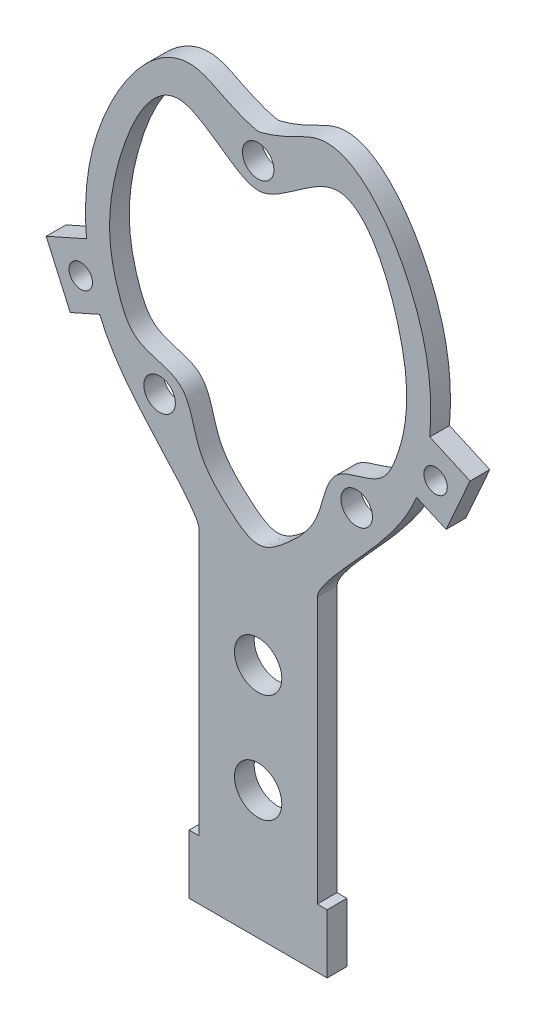
from build123d import *

# Parameters (mm, degrees)
SKETCH2_R           = 1.2
SKETCH2_R_2         = 0.8
BOSS_EXTRUDE2_DEPTH = 1
BOSS_EXTRUDE3_DEPTH = 1
SKETCH4_R           = 0.594999999
CUT_EXTRUDE10_DEPTH = 10


with BuildPart() as part:
    # Sketch2 → Boss-Extrude2 (new body)
    with BuildSketch(Plane.XY):
        with BuildLine():
            Line((-3, -25.6), (-3.5, -25.6))
            Line((-3.5, -25.6), (-3.5, -28.6))
            Line((-3.5, -28.6), (3.5, -28.6))
            Line((3.5, -28.6), (3.5, -25.6))
            Line((3.5, -25.6), (3, -25.6))
            Line((3, -25.6), (3, -12.1))
            add(Edge.make_bspline(
                [(3, -12.1), (3.058103828, -11.435870201), (7.372156419, -7.261735624), (8.816301548, -3.819636641), (8.795211315, 3.088220748), (4.729906031, 9.502714417), (1.543138013, 7.285247455), (0.138381747, 6.848730149), (-0.138381747, 6.848730149), (-1.543138013, 7.285247455), (-4.729906031, 9.502714417), (-8.795211315, 3.088220748), (-8.816301548, -3.819636641), (-7.372156419, -7.261735624), (-3.058103828, -11.435870201), (-3, -12.1)],
                knots=[0.110531839, 0.110531839, 0.110531839, 0.110531839, 0.195870509, 0.310871915, 0.375079995, 0.502014152, 0.537662278, 0.553505555, 0.557026284, 0.572869561, 0.608517687, 0.735451844, 0.799659924, 0.91466133, 1, 1, 1, 1], degree=3))
            Line((-3, -12.1), (-3, -25.6))
        make_face()
        with Locations((0, -16.6)):
            Circle(SKETCH2_R, mode=Mode.SUBTRACT)
        with Locations((0, 5.55)):
            Circle(SKETCH2_R_2, mode=Mode.SUBTRACT)
        with Locations((-5, -7.2)):
            Circle(SKETCH2_R_2, mode=Mode.SUBTRACT)
        with Locations(Location((5, -7.2, 0), (0, 0, 180))):
            Circle(SKETCH2_R_2, mode=Mode.SUBTRACT)
        with Locations((0, -22.1)):
            Circle(SKETCH2_R, mode=Mode.SUBTRACT)
        with BuildLine():
            add(Edge.make_bspline(
                [(0, 4.25), (-0.417612959, 4.25), (-1.806909343, 5.016290019), (-4.901204561, 7.754060047), (-7.771028928, 1.128148542), (-7.631282508, -2.661392118), (-6.25678999, -5.757950433), (-3.501481263, -5.76089978), (-3.230109482, -8.784428483), (-1.74530404, -10.314020364), (0, -11.677388837), (1.74530404, -10.314020364), (3.230109482, -8.784428483), (3.501481263, -5.76089978), (6.25678999, -5.757950433), (7.631282508, -2.661392118), (7.771028928, 1.128148542), (4.901204561, 7.754060047), (1.806909343, 5.016290019), (0.417612959, 4.25), (0, 4.25)],
                knots=[0, 0, 0, 0, 0.025607361, 0.08518944, 0.194127412, 0.298810242, 0.326537395, 0.373370364, 0.421073963, 0.469790648, 0.5, 0.530209352, 0.578926037, 0.626629636, 0.673462605, 0.701189758, 0.805872588, 0.91481056, 0.974392639, 1, 1, 1, 1], degree=3))
        make_face(mode=Mode.SUBTRACT)
    extrude(amount=BOSS_EXTRUDE2_DEPTH)

    # Sketch3 → Boss-Extrude3 (add)
    with BuildSketch(Plane.XY):
        Polygon((-6.791190485, -4.658529061), (-9.531826857, -5.87873899), (-10.752036787, -3.138102617), (-8.011400414, -1.917892688), align=None)
        Polygon((8.011400414, -1.917892688), (10.752036787, -3.138102617), (9.531826857, -5.87873899), (6.791190485, -4.658529061), align=None)
    extrude(amount=BOSS_EXTRUDE3_DEPTH)

    # Sketch4 → Cut-Extrude10 (cut)
    with BuildSketch(Plane.XY):
        with Locations((-8.999999996, -4.000000008)):
            Circle(SKETCH4_R)
        with Locations(Location((8.999999996, -4.000000008, 0), (0, 0, 180))):
            Circle(SKETCH4_R)
    extrude(amount=CUT_EXTRUDE10_DEPTH, mode=Mode.SUBTRACT)


solid = part.part
